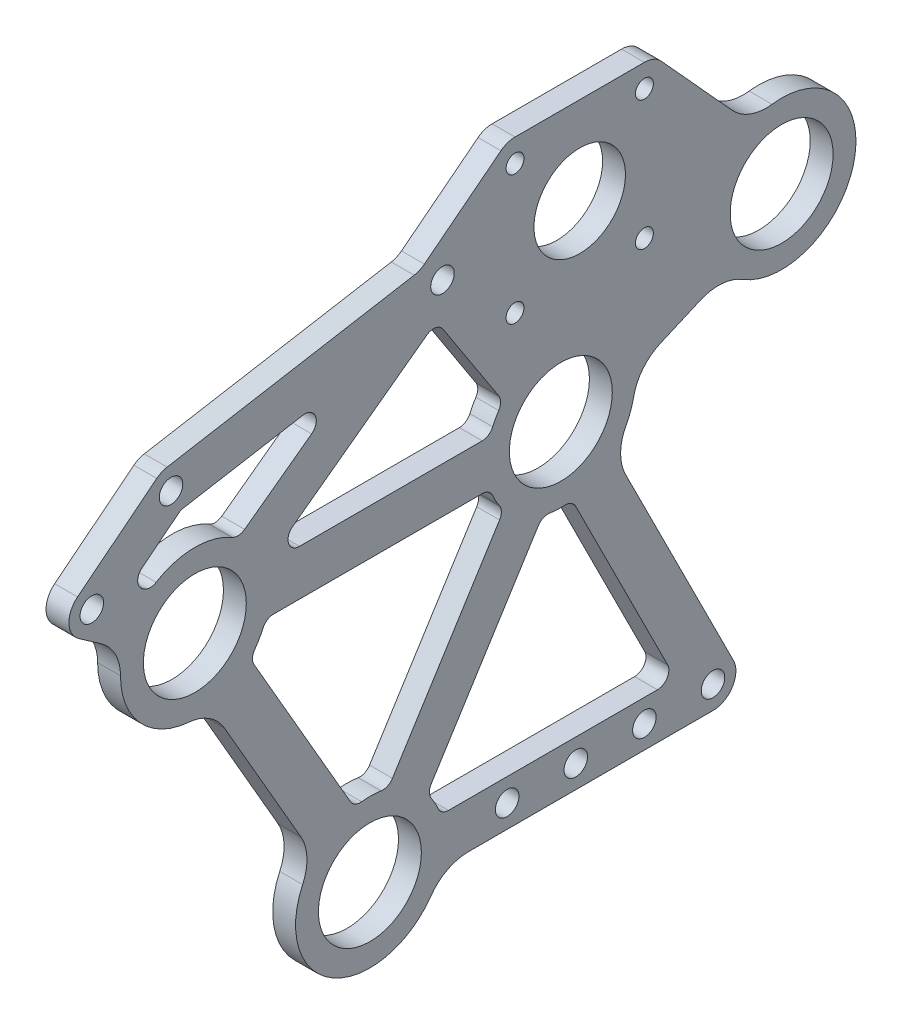
from build123d import *

# Parameters (mm, degrees)
SKETCH1_R           = 14.2875
SKETCH1_R_2         = 3.2639
SKETCH1_R_3         = 2.4892
SKETCH1_R_4         = 12.7
BOSS_EXTRUDE1_DEPTH = 6.35
FILLET1_R           = 12.7
CUT_EXTRUDE1_DEPTH  = 1111.646166548
FILLET2_R           = 3.175


with BuildPart() as part:
    # Sketch1 → Boss-Extrude1 (new body)
    with BuildSketch(Plane(origin=(0, 0, 0), x_dir=(0, 0, -1), z_dir=(1, 0, 0))):
        with BuildLine():
            ThreePointArc((-970.159977951, 486.471044057), (-972.554742028, 481.307456029), (-969.849900837, 476.299325595))
            Line((-969.849900837, 476.299325595), (-957.32612323, 467.530082108))
            ThreePointArc((-957.32612323, 467.530082108), (-952.814366358, 447.526291127), (-933.279921362, 441.288257591))
            Line((-933.279921362, 441.288257591), (-904.317406585, 391.123710482))
            ThreePointArc((-904.317406585, 391.123710482), (-899.31875, 359.420584766), (-869.363709458, 370.943184037))
            Line((-869.363709458, 370.943184037), (-793.75, 370.943184037))
            ThreePointArc((-793.75, 370.943184037), (-788.345816721, 373.958922036), (-788.074736079, 380.141671253))
            Line((-788.074736079, 380.141671253), (-821.515081147, 446.767486803))
            ThreePointArc((-821.515081147, 446.767486803), (-816.600560548, 454.425027508), (-815.456796251, 463.451779173))
            Line((-815.456796251, 463.451779173), (-790.191295152, 474.402994585))
            ThreePointArc((-790.191295152, 474.402994585), (-754.524902303, 483.694296655), (-783.206575716, 506.841250736))
            Line((-783.206575716, 506.841250736), (-808.094430848, 534.22843431))
            ThreePointArc((-808.094430848, 534.22843431), (-810.224397121, 535.764782193), (-812.79386882, 536.307862598))
            Line((-812.79386882, 536.307862598), (-848.714893304, 536.307862598))
            ThreePointArc((-848.714893304, 536.307862598), (-850.783311047, 535.961540474), (-852.626110261, 534.96035017))
            Line((-852.626110261, 534.96035017), (-873.884548632, 518.339346434))
            ThreePointArc((-873.884548632, 518.339346434), (-875.222451174, 517.536616274), (-876.715710426, 517.084360008))
            Line((-876.715710426, 517.084360008), (-945.294856051, 505.247433425))
            ThreePointArc((-945.294856051, 505.247433425), (-946.812001144, 504.784530233), (-948.167088373, 503.960062407))
            Line((-948.167088373, 503.960062407), (-970.159977951, 486.471044057))
        make_face()
        with Locations((-774.7, 488.038469669)):
            Circle(SKETCH1_R, mode=Mode.SUBTRACT)
        with Locations((-835.998805319, 461.468784037)):
            Circle(SKETCH1_R, mode=Mode.SUBTRACT)
        with Locations((-889, 377.293184037)):
            Circle(SKETCH1_R, mode=Mode.SUBTRACT)
        with Locations((-937.598805319, 461.468784037)):
            Circle(SKETCH1_R, mode=Mode.SUBTRACT)
        with Locations((-850.9, 377.293184037)):
            Circle(SKETCH1_R_2, mode=Mode.SUBTRACT)
        with Locations((-831.85, 377.293184037)):
            Circle(SKETCH1_R_2, mode=Mode.SUBTRACT)
        with Locations((-812.8, 377.293184037)):
            Circle(SKETCH1_R_2, mode=Mode.SUBTRACT)
        with Locations((-793.75, 377.293184037)):
            Circle(SKETCH1_R_2, mode=Mode.SUBTRACT)
        with Locations((-966.207690466, 481.500941076)):
            Circle(SKETCH1_R_2, mode=Mode.SUBTRACT)
        with Locations((-944.214800888, 498.989959427)):
            Circle(SKETCH1_R_2, mode=Mode.SUBTRACT)
        with Locations((-868.854381062, 511.997350355)):
            Circle(SKETCH1_R_2, mode=Mode.SUBTRACT)
        with Locations((-848.714893304, 494.036838113)):
            Circle(SKETCH1_R_3, mode=Mode.SUBTRACT)
        with Locations((-812.79386882, 494.036838113)):
            Circle(SKETCH1_R_3, mode=Mode.SUBTRACT)
        with Locations((-830.754381062, 511.997350355)):
            Circle(SKETCH1_R_4, mode=Mode.SUBTRACT)
        with Locations((-848.714893304, 529.957862598)):
            Circle(SKETCH1_R_3, mode=Mode.SUBTRACT)
        with Locations((-812.79386882, 529.957862598)):
            Circle(SKETCH1_R_3, mode=Mode.SUBTRACT)
    extrude(amount=BOSS_EXTRUDE1_DEPTH)

    # Fillet1
    fillet1_edges = [part.edges().sort_by_distance(p)[0] for p in [
        (3.175, 391.123710482, 904.317406585),
        (3.175, 441.288257591, 933.279921362),
        (3.175, 467.530082108, 957.32612323),
        (3.175, 506.841250736, 783.206575716),
        (3.175, 474.402994585, 790.191295152),
        (3.175, 463.451779173, 815.456796251),
        (3.175, 446.767486803, 821.515081147),
        (3.175, 370.943184037, 869.363709458),
    ]]
    fillet(fillet1_edges, radius=FILLET1_R)

    # Sketch2 → Cut-Extrude1 (cut, through all)
    with BuildSketch(Plane(origin=(6.35, 0, 0), x_dir=(0, 0, -1), z_dir=(1, 0, 0))):
        with BuildLine():
            Line((-941.533962306, 493.008784522), (-955.598677388, 481.824348785))
            Line((-955.598677388, 481.824348785), (-950.041702488, 477.93331307))
            ThreePointArc((-950.041702488, 477.93331307), (-937.835924045, 482.10492178), (-925.537513496, 478.214877486))
            Line((-925.537513496, 478.214877486), (-894.3242024, 501.157303389))
            Line((-894.3242024, 501.157303389), (-941.533962306, 493.008784522))
        make_face()
        with BuildLine():
            Line((-852.026643719, 474.469353351), (-870.512088457, 502.898105526))
            Line((-870.512088457, 502.898105526), (-910.437563384, 473.552059946))
            ThreePointArc((-910.437563384, 473.552059946), (-911.574059703, 470.004314737), (-908.557177951, 467.818784037))
            Line((-908.557177951, 467.818784037), (-855.635095861, 467.818784037))
            ThreePointArc((-855.635095861, 467.818784037), (-854.138266208, 471.310855207), (-852.026643719, 474.469353351))
        make_face()
        with BuildLine():
            ThreePointArc((-917.962514777, 455.118784037), (-919.726206049, 451.150034037), (-922.281398734, 447.638257591))
            Line((-922.281398734, 447.638257591), (-893.318883957, 397.473710482))
            ThreePointArc((-893.318883957, 397.473710482), (-888.604427978, 397.926892599), (-883.91080583, 397.29334676))
            Line((-883.91080583, 397.29334676), (-851.835056229, 448.235509183))
            ThreePointArc((-851.835056229, 448.235509183), (-854.065907119, 451.494505176), (-855.635095861, 455.118784037))
            Line((-855.635095861, 455.118784037), (-917.962514777, 455.118784037))
        make_face()
        with BuildLine():
            Line((-804.042101766, 383.643184037), (-832.86560899, 441.07051237))
            ThreePointArc((-832.86560899, 441.07051237), (-836.996855705, 440.855431527), (-841.08799949, 441.468621314))
            Line((-841.08799949, 441.468621314), (-873.16374909, 390.526458891))
            ThreePointArc((-873.16374909, 390.526458891), (-870.9328982, 387.267462898), (-869.363709458, 383.643184037))
            Line((-869.363709458, 383.643184037), (-804.042101766, 383.643184037))
        make_face()
    extrude(amount=-CUT_EXTRUDE1_DEPTH, mode=Mode.SUBTRACT)

    # Fillet2
    fillet2_edges = [part.edges().sort_by_distance(p)[0] for p in [
        (3.175, 478.214877486, 925.537513496),
        (3.175, 477.93331307, 950.041702488),
        (3.175, 481.824348785, 955.598677388),
        (3.175, 493.008784522, 941.533962306),
        (3.175, 501.157303389, 894.3242024),
        (3.175, 397.29334676, 883.91080583),
        (3.175, 397.473710482, 893.318883957),
        (3.175, 447.638257591, 922.281398734),
        (3.175, 455.118784037, 917.962514777),
        (3.175, 455.118784037, 855.635095861),
        (3.175, 448.235509183, 851.835056229),
        (3.175, 383.643184037, 869.363709458),
        (3.175, 390.526458891, 873.16374909),
        (3.175, 441.468621314, 841.08799949),
        (3.175, 441.07051237, 832.86560899),
        (3.175, 383.643184037, 804.042101766),
        (3.175, 502.898105526, 870.512088457),
        (3.175, 474.469353351, 852.026643719),
        (3.175, 467.818784037, 855.635095861),
    ]]
    fillet(fillet2_edges, radius=FILLET2_R)


solid = part.part
